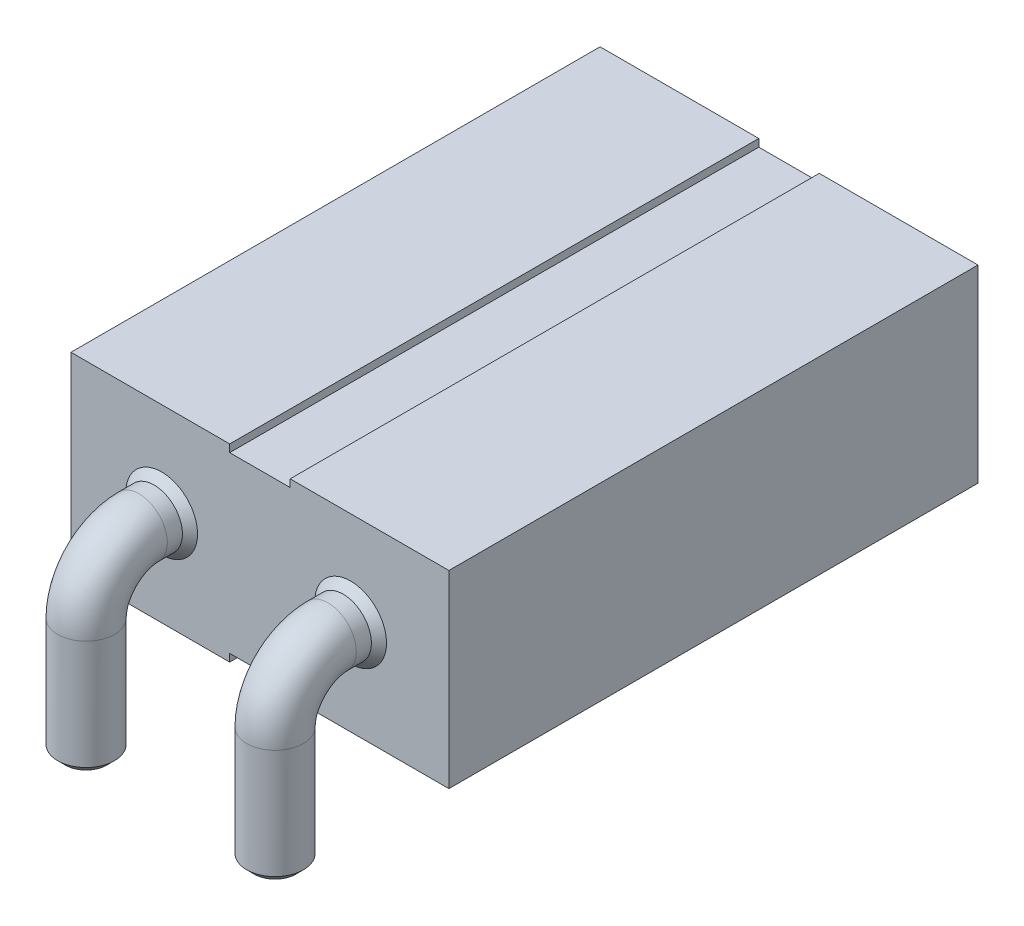
from build123d import *

# Parameters (mm, degrees)
SKETCH1_W                  = 5
SKETCH1_H                  = 7
BOSS_EXTRUDE1_DEPTH        = 2.5
SKETCH2_R                  = 0.75
CUT_EXTRUDE1_DEPTH         = 6.5
SKETCH4_R                  = 0.375
CHAMFER1_SIZE              = 0.1
SKETCH5_W                  = 0.8
SKETCH5_H                  = 0.1
CUT_EXTRUDE2_DEPTH         = 10.09068901
LPATTERN1_COUNT            = 2
LPATTERN1_PITCH            = 2.5
LPATTERN2_COUNT            = 2
LPATTERN2_PITCH            = 2.5
CHAMFER1_OF_LPATTERN2_SIZE = 0.1


with BuildPart() as part:
    # Sketch1 → Boss-Extrude1 (new body)
    with BuildSketch(Plane(origin=(0, 0, 0), x_dir=(1, 0, 0), z_dir=(0, 1, 0))):
        Rectangle(SKETCH1_W, SKETCH1_H)
    extrude(amount=BOSS_EXTRUDE1_DEPTH)

    # Sketch2 → Cut-Extrude1 (cut)
    with BuildSketch(Plane(origin=(0, 0, -3.5), x_dir=(-1, 0, 0), z_dir=(0, 0, -1))):
        with Locations((-1.2, 1.25)):
            Circle(SKETCH2_R)
    cut_extrude1 = extrude(amount=-CUT_EXTRUDE1_DEPTH, mode=Mode.SUBTRACT)

    # Sweep1: sweep along a path in Sketch3
    with BuildLine(Plane(origin=(1.2, 0, 0), x_dir=(0, 0, -1), z_dir=(1, 0, 0))) as sweep1_path:
        Line((-3.5, 1.254208417), (-3.8, 1.254208417))
        ThreePointArc((-3.8, 1.254208417), (-4.294974747, 1.049183164), (-4.5, 0.554208417))
        Line((-4.5, 0.554208417), (-4.5, -0.992950224))
    # Sketch4 → Sweep1 (sweep)
    with BuildSketch(Plane.XY.offset(3.5)):
        with Locations((1.2, 1.254208417)):
            Circle(SKETCH4_R)
    sweep1 = sweep(path=sweep1_path.line)

    # Chamfer1
    chamfer1_edges = [part.edges().sort_by_distance(p)[0] for p in [
        (0.825, 1.254208417, 3.5),
        (0.825, -0.992950224, 4.5),
    ]]
    chamfer(chamfer1_edges, length=CHAMFER1_SIZE)

    # Sketch5 → Cut-Extrude2 (cut, through all)
    with BuildSketch(Plane(origin=(0, 0, -3.5), x_dir=(-1, 0, 0), z_dir=(0, 0, -1))):
        with Locations((0, 2.45)):
            Rectangle(SKETCH5_W, SKETCH5_H)
    cut_extrude2 = extrude(amount=-CUT_EXTRUDE2_DEPTH, mode=Mode.SUBTRACT)

    # Mirror6: Cut-Extrude2 across plane
    add(cut_extrude2.mirror(Plane(origin=(0, 1.25, 0), x_dir=(0, 0, 1), z_dir=(0, -1, 0))), mode=Mode.SUBTRACT)

    # LPattern1: Cut-Extrude1 ×2
    with Locations(*[(-i * LPATTERN1_PITCH, 0, 0) for i in range(1, LPATTERN1_COUNT)]):
        add(cut_extrude1, mode=Mode.SUBTRACT)

    # LPattern2: Sweep1 ×2
    with Locations(*[(-i * LPATTERN2_PITCH, 0, 0) for i in range(1, LPATTERN2_COUNT)]):
        add(sweep1)

    # Chamfer1 of LPattern2
    chamfer1_of_lpattern2_edges = [part.edges().sort_by_distance(p)[0] for p in [
        (-1.675, 1.254208417, 3.5),
        (-1.675, -0.992950224, 4.5),
    ]]
    chamfer(chamfer1_of_lpattern2_edges, length=CHAMFER1_OF_LPATTERN2_SIZE)


solid = part.part
